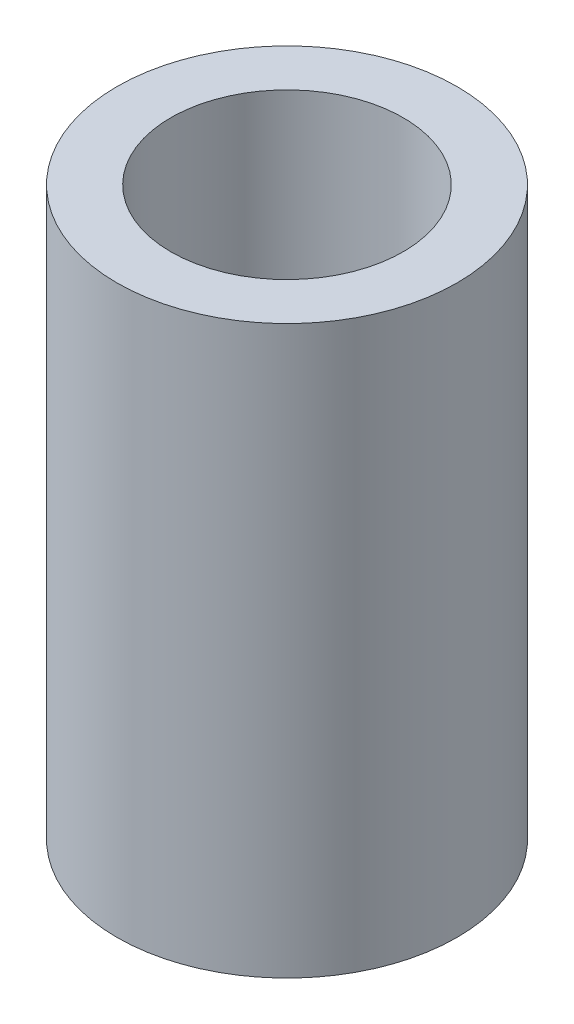
from build123d import *

# Parameters (mm, degrees)
SKETCH1_R           = 6
BOSS_EXTRUDE1_DEPTH = 20
SKETCH2_R           = 4.1
CUT_EXTRUDE1_DEPTH  = 40


with BuildPart() as part:
    # Sketch1 → Boss-Extrude1 (new body)
    with BuildSketch(Plane(origin=(0, 470, 0), x_dir=(1, 0, 0), z_dir=(0, 1, 0))):
        with Locations(Location((300, -157, 0), (0, 0, 270))):
            Circle(SKETCH1_R)
    extrude(amount=BOSS_EXTRUDE1_DEPTH)

    # Sketch2 → Cut-Extrude1 (cut)
    with BuildSketch(Plane(origin=(0, 490, 0), x_dir=(1, 0, 0), z_dir=(0, 1, 0))):
        with Locations(Location((300, -157, 0), (0, 0, 270))):
            Circle(SKETCH2_R)
    extrude(amount=-CUT_EXTRUDE1_DEPTH, mode=Mode.SUBTRACT)


solid = part.part
